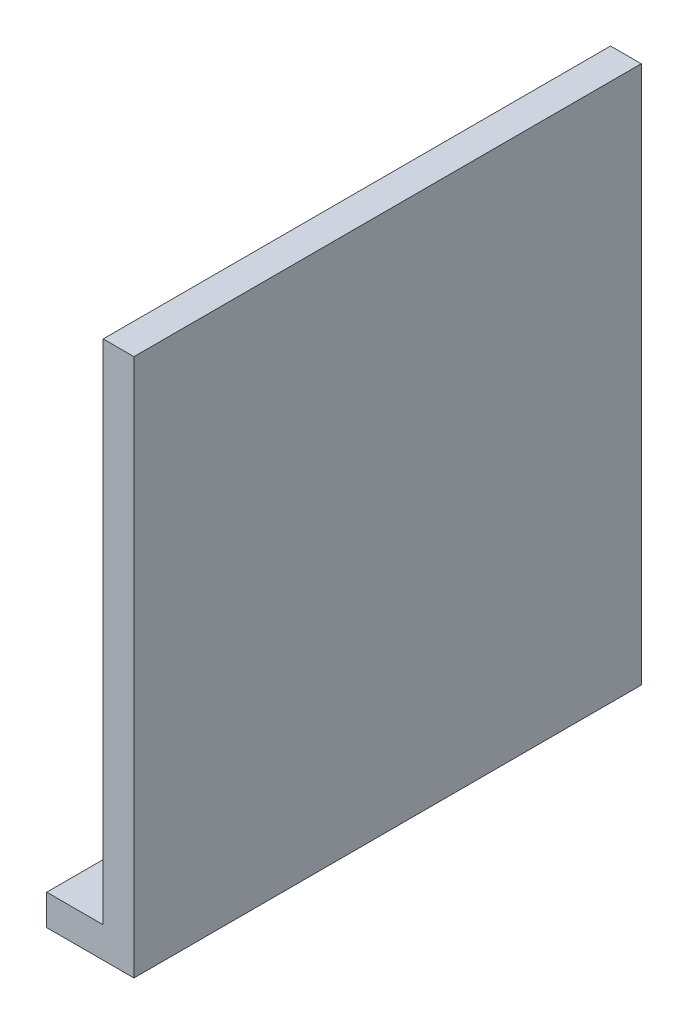
from build123d import *

# Parameters (mm, degrees)
SKETCH1_W           = 11.35
SKETCH1_H           = 66.04
BOSS_EXTRUDE1_DEPTH = 4
SKETCH2_W           = 4
SKETCH2_H           = 66.04
BOSS_EXTRUDE2_DEPTH = 66.04
SKETCH3_R           = 2.1
CUT_EXTRUDE1_DEPTH  = 4


with BuildPart() as part:
    # Sketch1 → Boss-Extrude1 (new body)
    with BuildSketch(Plane(origin=(0, 0, 0), x_dir=(1, 0, 0), z_dir=(0, 1, 0))):
        with Locations((-5.675, 0)):
            Rectangle(SKETCH1_W, SKETCH1_H)
    extrude(amount=BOSS_EXTRUDE1_DEPTH)

    # Sketch2 → Boss-Extrude2 (add)
    with BuildSketch(Plane(origin=(0, 4, 0), x_dir=(1, 0, 0), z_dir=(0, 1, 0))):
        with Locations((-2, 0)):
            Rectangle(SKETCH2_W, SKETCH2_H)
    extrude(amount=BOSS_EXTRUDE2_DEPTH)

    # Sketch3 → Cut-Extrude1 (cut)
    with BuildSketch(Plane(origin=(0, 4, 0), x_dir=(1, 0, 0), z_dir=(0, 1, 0))):
        with Locations(Location((-7.903537156, 25.4, 0), (0, 0, 270))):
            Circle(SKETCH3_R)
        with Locations(Location((-7.903537156, -25.4, 0), (0, 0, 270))):
            Circle(SKETCH3_R)
    extrude(amount=-CUT_EXTRUDE1_DEPTH, mode=Mode.SUBTRACT)


solid = part.part
